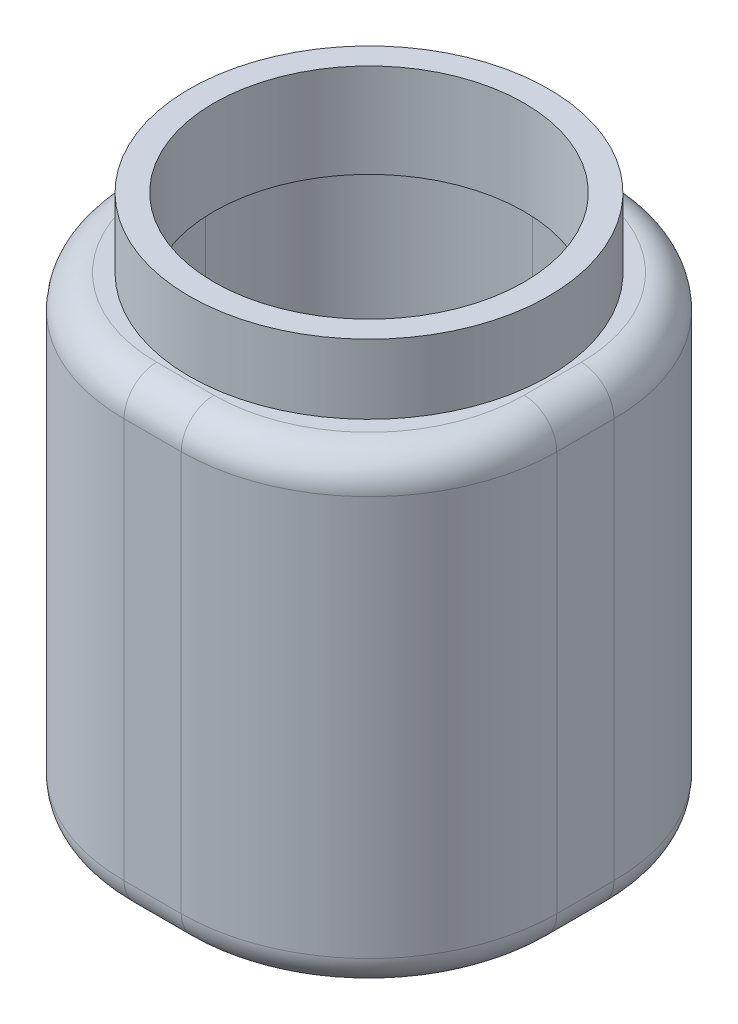
from build123d import *

# Parameters (mm, degrees)
SKETCH1_W           = 134.62
SKETCH1_H           = 134.62
BOSS_EXTRUDE1_DEPTH = 144.78
FILLET1_R           = 58.42
FILLET2_R           = 10.16
SKETCH2_R           = 55.88
BOSS_EXTRUDE2_DEPTH = 21.59
SHELL1_T            = -7.62


with BuildPart() as part:
    # Sketch1 → Boss-Extrude1 (new body)
    with BuildSketch(Plane(origin=(0, 0, 0), x_dir=(1, 0, 0), z_dir=(0, 1, 0))):
        Rectangle(SKETCH1_W, SKETCH1_H)
    extrude(amount=BOSS_EXTRUDE1_DEPTH)

    # Fillet1
    fillet1_edges = [part.edges().sort_by_distance(p)[0] for p in [
        (67.31, 72.39, 67.31),
        (-67.31, 72.39, 67.31),
        (-67.31, 72.39, -67.31),
        (67.31, 72.39, -67.31),
    ]]
    fillet(fillet1_edges, radius=FILLET1_R)

    # Fillet2
    fillet2_edges = [part.edges().sort_by_distance(p)[0] for p in [
        (67.31, 0, 0),
        (67.31, 144.78, 0),
        (0, 0, 67.31),
        (-67.31, 0, 0),
        (0, 0, -67.31),
        (-50.199178157, 0, -50.199178157),
        (50.199178157, 0, -50.199178157),
        (-50.199178157, 0, 50.199178157),
        (50.199178157, 0, 50.199178157),
        (0, 144.78, 67.31),
        (0, 144.78, -67.31),
        (-67.31, 144.78, 0),
        (-50.199178157, 144.78, -50.199178157),
        (50.199178157, 144.78, -50.199178157),
        (-50.199178157, 144.78, 50.199178157),
        (50.199178157, 144.78, 50.199178157),
    ]]
    fillet(fillet2_edges, radius=FILLET2_R)

    # Sketch2 → Boss-Extrude2 (add)
    with BuildSketch(Plane(origin=(0, 144.78, 0), x_dir=(1, 0, 0), z_dir=(0, 1, 0))):
        with Locations(Location((0, 0, 0), (0, 0, 270))):
            Circle(SKETCH2_R)
    extrude(amount=BOSS_EXTRUDE2_DEPTH)

    # Shell1
    shell1_openings = [part.faces().sort_by_distance(p)[0] for p in [
        (0, 166.37, 0),
    ]]
    offset(amount=SHELL1_T, openings=shell1_openings, kind=Kind.INTERSECTION)


solid = part.part
